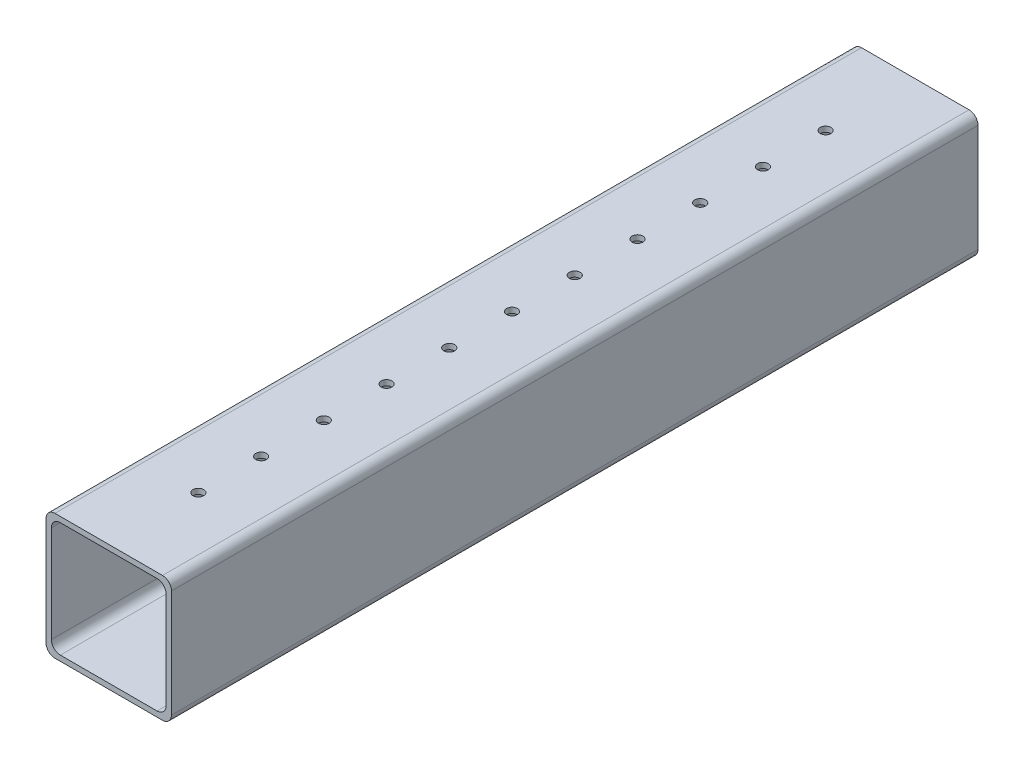
from build123d import *

# Parameters (mm, degrees)
SKETCH1_W           = 70
SKETCH1_H           = 70
SKETCH1_W_2         = 64
SKETCH1_H_2         = 64
BOSS_EXTRUDE1_DEPTH = 450
FILLET1_R           = 5
SKETCH3_R           = 3
CUT_EXTRUDE2_DEPTH  = 173
LPATTERN1_COUNT     = 6
LPATTERN1_PITCH     = 35
LPATTERN1_COL_COUNT = 6
LPATTERN1_COL_PITCH = 35


with BuildPart() as part:
    # Sketch1 → Boss-Extrude1 (new body)
    with BuildSketch(Plane.XY):
        with Locations((35, 35)):
            Rectangle(SKETCH1_W, SKETCH1_H)
        with Locations((35, 35)):
            Rectangle(SKETCH1_W_2, SKETCH1_H_2, mode=Mode.SUBTRACT)
    extrude(amount=BOSS_EXTRUDE1_DEPTH)

    # Fillet1
    fillet1_edges = [part.edges().sort_by_distance(p)[0] for p in [
        (3, 67, 225),
        (3, 3, 225),
        (67, 3, 225),
        (67, 67, 225),
        (0, 70, 225),
        (70, 70, 225),
        (70, 0, 225),
        (0, 0, 225),
    ]]
    fillet(fillet1_edges, radius=FILLET1_R)

    # Sketch3 → Cut-Extrude2 (cut)
    with BuildSketch(Plane.XZ):
        with Locations(Location((35, 225, 0), (0, 0, 270))):
            Circle(SKETCH3_R)
    cut_extrude2 = extrude(amount=-CUT_EXTRUDE2_DEPTH, mode=Mode.SUBTRACT)

    # LPattern1: Cut-Extrude2 ×6
    with Locations(*[(0, 0, -i * LPATTERN1_PITCH) for i in range(1, LPATTERN1_COUNT)]):
        add(cut_extrude2, mode=Mode.SUBTRACT)

    # LPattern1 col: Cut-Extrude2 ×6
    with Locations(*[(0, 0, i * LPATTERN1_COL_PITCH) for i in range(1, LPATTERN1_COL_COUNT)]):
        add(cut_extrude2, mode=Mode.SUBTRACT)


solid = part.part
